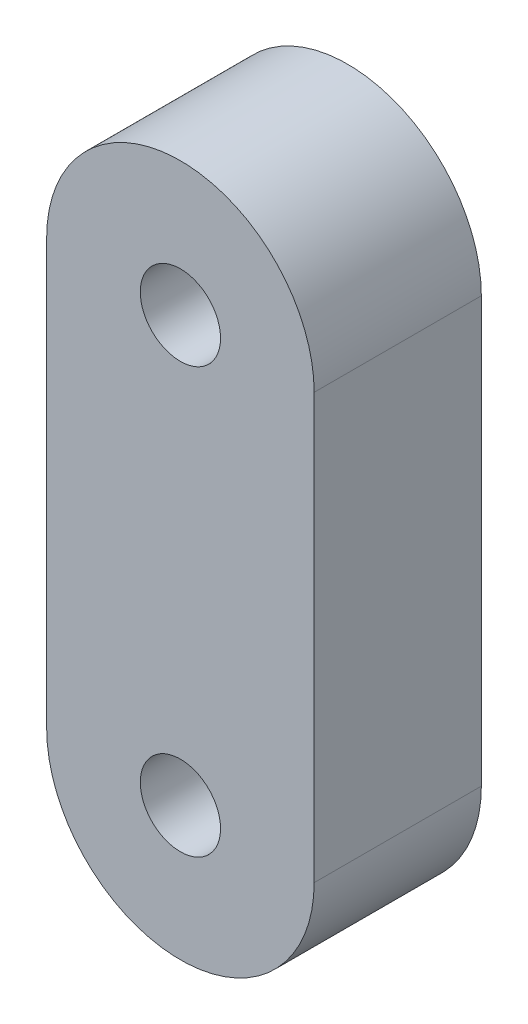
from build123d import *

# Parameters (mm, degrees)
SKETCH_1_R      = 1.2
EXTRUDE_1_DEPTH = 5


with BuildPart() as part:
    # 草图1 → 凸台-拉伸1 (new body)
    with BuildSketch(Plane.XY):
        with BuildLine():
            Line((-4, -6.35), (-4, 6.35))
            ThreePointArc((-4, 6.35), (0, 10.35), (4, 6.35))
            Line((4, 6.35), (4, -6.35))
            ThreePointArc((4, -6.35), (0, -10.35), (-4, -6.35))
        make_face()
        with Locations((0, 6.35)):
            Circle(SKETCH_1_R, mode=Mode.SUBTRACT)
        with Locations((0, -6.35)):
            Circle(SKETCH_1_R, mode=Mode.SUBTRACT)
    extrude(amount=EXTRUDE_1_DEPTH)


solid = part.part
